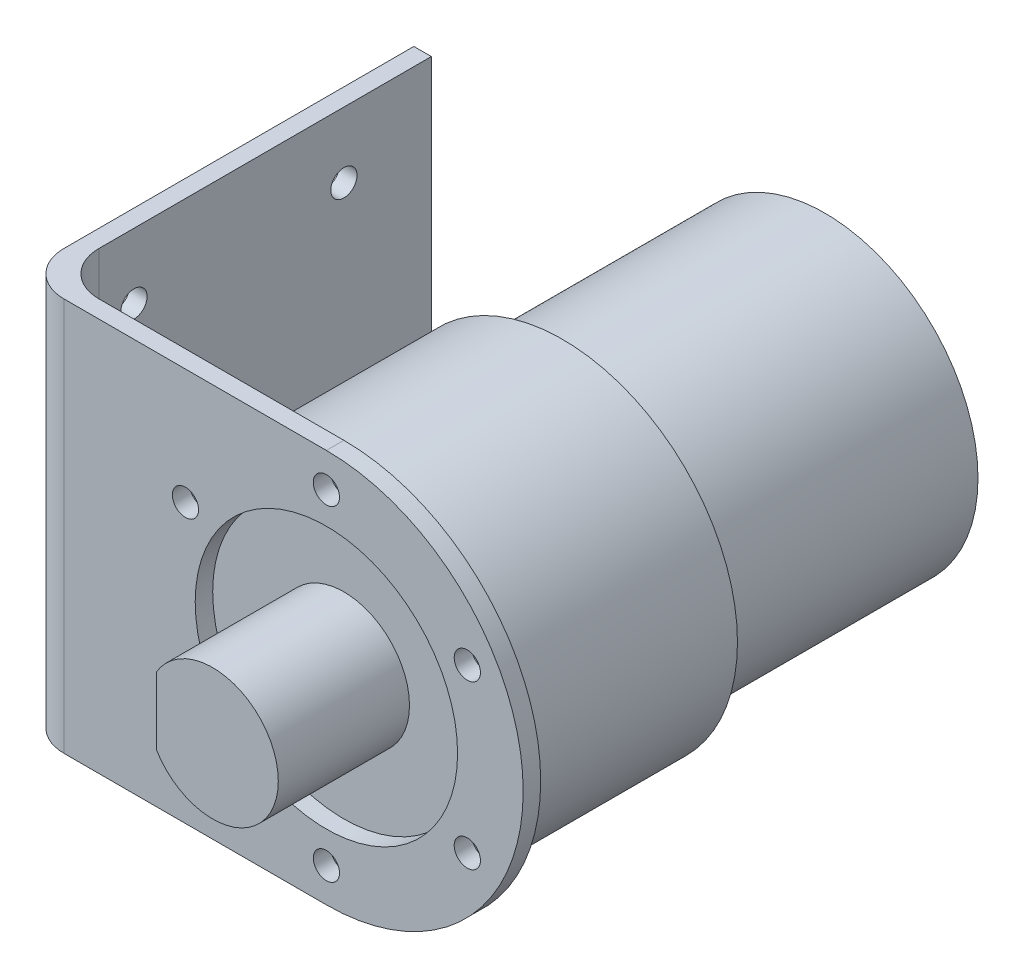
from build123d import *

# Parameters (mm, degrees)
SKETCH_1_R          = 17.5
EXTRUDE_1_DEPTH     = 30
SKETCH_2_R          = 20
EXTRUDE_2_DEPTH     = 25
EXTRUDE_5_DEPTH     = 2
SKETCH_7_W          = 2
SKETCH_7_H          = 45
EXTRUDE_6_DEPTH     = 45
FILLET_3_R          = 5
SKETCH_8_R          = 1.5
CUT_EXTRUDE_1_DEPTH = 5
SKETCH_9_R          = 15
CUT_EXTRUDE_2_DEPTH = 10
EXTRUDE_7_DEPTH     = 70
SKETCH_11_R         = 1.5
CUT_EXTRUDE_3_DEPTH = 2


with BuildPart() as part:
    # 草图1 → 凸台-拉伸1 (new body)
    with BuildSketch(Plane.XY):
        Circle(SKETCH_1_R)
    extrude(amount=EXTRUDE_1_DEPTH)

    # 草图2 → 凸台-拉伸2 (add)
    with BuildSketch(Plane.XY.offset(30)):
        Circle(SKETCH_2_R)
    extrude(amount=EXTRUDE_2_DEPTH)

    # 草图6 → 凸台-拉伸5 (add)
    with BuildSketch(Plane.XY.offset(55)):
        with BuildLine():
            Line((0, 22.5), (-35, 22.5))
            Line((-35, 22.5), (-35, -22.5))
            Line((-35, -22.5), (0, -22.5))
            ThreePointArc((0, -22.5), (22.5, 0), (0, 22.5))
        make_face()
    extrude(amount=EXTRUDE_5_DEPTH)

    # 草图7 → 凸台-拉伸6 (add)
    with BuildSketch(Plane.XY.offset(57)):
        with Locations((-34, 0)):
            Rectangle(SKETCH_7_W, SKETCH_7_H)
    extrude(amount=-EXTRUDE_6_DEPTH)

    # 圆角3
    fillet_3_edges = [part.edges().sort_by_distance(p)[0] for p in [
        (-35, 0, 57),
        (-33, 0, 55),
    ]]
    fillet(fillet_3_edges, radius=FILLET_3_R)

    # 草图8 → 切除-拉伸1 (cut)
    with BuildSketch(Plane.ZY.offset(35)):
        with Locations((22, 15)):
            Circle(SKETCH_8_R)
        with Locations((22, -15)):
            Circle(SKETCH_8_R)
        with Locations((46, 15)):
            Circle(SKETCH_8_R)
        with Locations((46, -15)):
            Circle(SKETCH_8_R)
    extrude(amount=-CUT_EXTRUDE_1_DEPTH, mode=Mode.SUBTRACT)

    # 草图9 → 切除-拉伸2 (cut)
    with BuildSketch(Plane(origin=(0, 0, 55), x_dir=(-1, 0, 0), z_dir=(0, 0, -1))):
        Circle(SKETCH_9_R)
    extrude(amount=-CUT_EXTRUDE_2_DEPTH, mode=Mode.SUBTRACT)

    # 草图10 → 凸台-拉伸7 (add)
    with BuildSketch(Plane(origin=(0, 0, 0), x_dir=(-1, 0, 0), z_dir=(0, 0, -1))):
        with BuildLine():
            Line((6.4409075, 3.842487551), (6.4409075, -3.842487551))
            ThreePointArc((6.4409075, -3.842487551), (-7.5, 0), (6.4409075, 3.842487551))
        make_face()
    extrude(amount=-EXTRUDE_7_DEPTH)

    # 草图11 → 切除-拉伸3 (cut)
    with BuildSketch(Plane.XY.offset(57)):
        with Locations((0, 18.605053308)):
            Circle(SKETCH_11_R)
        with Locations((16.112448804, 9.302526654)):
            Circle(SKETCH_11_R)
        with Locations((16.112448804, -9.302526654)):
            Circle(SKETCH_11_R)
        with Locations((0, -18.605053308)):
            Circle(SKETCH_11_R)
        with Locations((-16.112448804, -9.302526654)):
            Circle(SKETCH_11_R)
        with Locations((-16.112448804, 9.302526654)):
            Circle(SKETCH_11_R)
    extrude(amount=-CUT_EXTRUDE_3_DEPTH, mode=Mode.SUBTRACT)


solid = part.part
